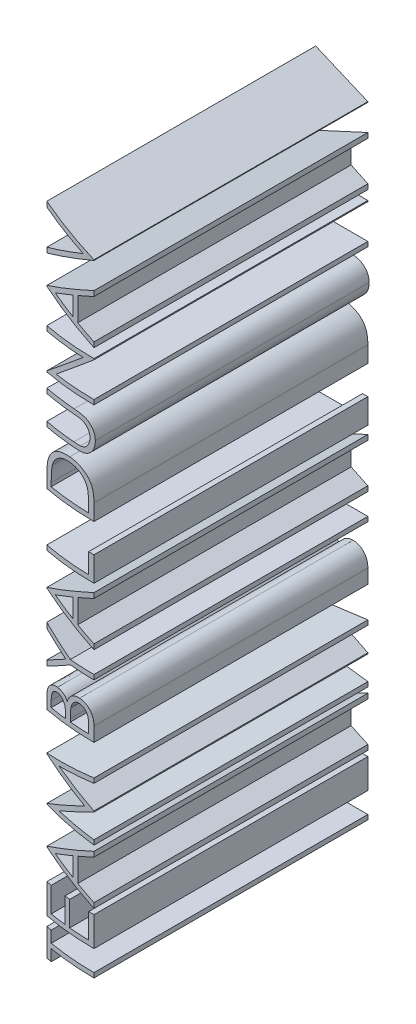
from build123d import *

# Parameters (mm, degrees)
BOSS_EXTRUDE4_DEPTH    = 58
BOSS_EXTRUDE4_2_DEPTH  = 58
BOSS_EXTRUDE4_3_DEPTH  = 58
BOSS_EXTRUDE4_4_DEPTH  = 58
BOSS_EXTRUDE4_5_DEPTH  = 58
BOSS_EXTRUDE4_6_DEPTH  = 58
BOSS_EXTRUDE4_7_DEPTH  = 58
BOSS_EXTRUDE4_8_DEPTH  = 58
BOSS_EXTRUDE4_9_DEPTH  = 58
BOSS_EXTRUDE4_10_DEPTH = 58
BOSS_EXTRUDE4_11_DEPTH = 58
BOSS_EXTRUDE4_12_DEPTH = 58
BOSS_EXTRUDE4_13_DEPTH = 58
SKETCH6_R              = 76.53207951
SKETCH6_R_2            = 50
CUT_EXTRUDE2_DEPTH     = 144


with BuildPart() as part:
    # Sketch4 → Boss-Extrude4 (new body)
    with BuildSketch(Plane.XY):
        Polygon((-8.548076923, 14.736057692), (-9.525, 14.736057692), (-9.525, 19.742788462), (-8.548076923, 19.742788462), (-8.548076923, 17.666826923), (0, 17.666826923), (0, 16.812019231), (-8.548076923, 16.812019231), align=None)
    extrude(amount=BOSS_EXTRUDE4_DEPTH)


with BuildPart() as body_2:
    # Sketch4 → Boss-Extrude4 2 (new body)
    with BuildSketch(Plane.XY):
        Polygon((-9.525, 21.452403846), (-9.525, 26.825480769), (-8.548076923, 26.825480769), (-8.548076923, 22.307211538), (-5.617307692, 22.307211538), (-5.617307692, 26.825480769), (-4.640384615, 26.825480769), (-4.640384615, 22.307211538), (-0.976923077, 22.307211538), (-0.976923077, 26.825480769), (0, 26.825480769), (0, 21.452403846), align=None)
    extrude(amount=BOSS_EXTRUDE4_2_DEPTH)


with BuildPart() as body_3:
    # Sketch4 → Boss-Extrude4 3 (new body)
    with BuildSketch(Plane.XY):
        Polygon((-9.525, 32.442788462), (0, 36.838942308), (0, 35.909720553), (-3.052884615, 34.501577524), (-3.052884615, 30.183653846), (0, 28.735441707), (0, 27.802403846), (-9.525, 32.320673077), align=None)
        Polygon((-7.668464543, 32.372190505), (-4.029807692, 30.647310697), (-4.029807692, 34.051277043), align=None, mode=Mode.SUBTRACT)
    extrude(amount=BOSS_EXTRUDE4_3_DEPTH)


with BuildPart() as body_4:
    # Sketch4 → Boss-Extrude4 4 (new body)
    with BuildSketch(Plane.XY):
        Polygon((0, 37.815865385), (-9.525, 39.073272236), (-9.525, 39.19538762), (-1.709615385, 43.127884615), (-9.525, 47.050841346), (-9.525, 47.174864784), (0, 48.439903846), (0, 47.581280048), (-6.853725962, 46.669230769), (0, 43.230919471), (0, 43.03820613), (-6.868990385, 39.586538462), (0, 38.676397236), align=None)
    extrude(amount=BOSS_EXTRUDE4_4_DEPTH)


with BuildPart() as body_5:
    # Sketch4 → Boss-Extrude4 5 (new body)
    with BuildSketch(Plane.XY):
        with BuildLine():
            Line((-9.525, 54.057211538), (-9.525, 55.915655048))
            add(Edge.make_bspline(
                [(-9.525, 55.915655048), (-9.524529238, 56.006629698), (-9.523616783, 56.182961212), (-9.509136788, 56.439353195), (-9.489887004, 56.679583574), (-9.457596527, 56.903227832), (-9.424115562, 57.111741188), (-9.374973522, 57.303006794), (-9.320694346, 57.478626738), (-9.237178469, 57.689510344), (-9.10747726, 57.928786691), (-8.915118041, 58.185963992), (-8.68449487, 58.409518194), (-8.421681576, 58.599605531), (-8.132557171, 58.752154663), (-7.82334226, 58.861121029), (-7.499239013, 58.931125173), (-7.27703627, 58.938234157), (-7.164738582, 58.941826923)],
                knots=[0, 0, 0, 0, 1.00128172, 1.940733171, 2.826250472, 3.653024905, 4.427672124, 5.149348099, 5.824709082, 6.450061444, 7.643590664, 8.808605388, 9.972104426, 11.165284501, 12.367876273, 13.557044126, 14.765369432, 16, 16, 16, 16], degree=3))
            add(Edge.make_bspline(
                [(-7.164738582, 58.941826923), (-7.059553037, 58.938834411), (-6.852853523, 58.932953843), (-6.551052971, 58.877406845), (-6.264058289, 58.78924582), (-5.992115101, 58.667403728), (-5.740285653, 58.51041701), (-5.509350044, 58.322324855), (-5.308036369, 58.096333634), (-5.195533021, 57.926929853), (-5.138386418, 57.840880409)],
                knots=[0, 0, 0, 0, 1.044641374, 2.052818814, 3.038628718, 4.023282556, 5.005660861, 5.98021751, 6.974042014, 8, 8, 8, 8], degree=3))
            add(Edge.make_bspline(
                [(-5.138386418, 57.840880409), (-5.096830362, 57.949075124), (-5.017323333, 58.156078416), (-4.876975624, 58.441109475), (-4.723772684, 58.685786279), (-4.559052161, 58.894888464), (-4.378882354, 59.072780297), (-4.181799464, 59.226844911), (-3.967964837, 59.360036772), (-3.738164382, 59.473382124), (-3.494346222, 59.562416312), (-3.239488355, 59.627855206), (-2.974567779, 59.666563734), (-2.794787371, 59.671844171), (-2.703710937, 59.674519231)],
                knots=[0, 0, 0, 0, 1.272586185, 2.434772614, 3.483318042, 4.437947805, 5.351807173, 6.25737843, 7.180033415, 8.1141739, 9.066731021, 10.025721652, 10.999834114, 12, 12, 12, 12], degree=3))
            add(Edge.make_bspline(
                [(-2.703710937, 59.674519231), (-2.610727857, 59.671861395), (-2.427781041, 59.666632029), (-2.159031401, 59.628033949), (-1.902176863, 59.562725382), (-1.655674409, 59.472612394), (-1.42004087, 59.355810963), (-1.196129866, 59.211613057), (-0.983475554, 59.042042927), (-0.781702626, 58.850401271), (-0.597074053, 58.636831638), (-0.438355745, 58.401464156), (-0.301880619, 58.150746748), (-0.190767438, 57.881474231), (-0.105043694, 57.594334001), (-0.045317822, 57.289485839), (-0.005007094, 56.967431785), (-0.001697351, 56.746423631), (0, 56.633082933)],
                knots=[0, 0, 0, 0, 0.978680899, 1.925582087, 2.851223405, 3.764209995, 4.683484765, 5.614004905, 6.562443559, 7.542772147, 8.539900013, 9.527881485, 10.525548727, 11.540192123, 12.58875426, 13.674701727, 14.807505862, 16, 16, 16, 16], degree=3))
            Line((0, 56.633082933), (0, 54.057211538))
            Line((0, 54.057211538), (-9.525, 54.057211538))
        make_face()
        with BuildLine():
            Line((-8.548076923, 54.912019231), (-5.495192308, 54.912019231))
            Line((-5.495192308, 54.912019231), (-5.495192308, 55.486343149))
            add(Edge.make_bspline(
                [(-5.495192308, 55.486343149), (-5.496280669, 55.570295942), (-5.498383606, 55.732509848), (-5.504407537, 55.967423278), (-5.521275062, 56.1854778), (-5.538137771, 56.386296975), (-5.565554964, 56.569564717), (-5.598190924, 56.7348745), (-5.63270572, 56.884822355), (-5.691409018, 57.057736642), (-5.778138227, 57.25390549), (-5.912865554, 57.462892786), (-6.073208084, 57.647987527), (-6.259951746, 57.80241527), (-6.463348431, 57.929918428), (-6.681612507, 58.0192384), (-6.91035169, 58.078785367), (-7.067684653, 58.084246494), (-7.147566106, 58.087019231)],
                knots=[0, 0, 0, 0, 1.156917035, 2.235399477, 3.236897345, 4.169954739, 5.01148057, 5.788325709, 6.491867502, 7.129259015, 8.302032419, 9.437271567, 10.542795419, 11.662606952, 12.764338259, 13.836858145, 14.901724648, 16, 16, 16, 16], degree=3))
            add(Edge.make_bspline(
                [(-7.147566106, 58.087019231), (-7.200438886, 58.085611406), (-7.304154617, 58.082849803), (-7.455839406, 58.059410619), (-7.598367472, 58.02143292), (-7.733106724, 57.970000878), (-7.856708571, 57.899737076), (-7.975079026, 57.818292098), (-8.081128279, 57.717736709), (-8.179961954, 57.604100192), (-8.268417762, 57.474079749), (-8.34168969, 57.324874086), (-8.408098402, 57.160340397), (-8.457258796, 56.976014794), (-8.500487656, 56.775716567), (-8.527648638, 56.556733602), (-8.545126988, 56.320453548), (-8.547071679, 56.156741148), (-8.548076923, 56.072115385)],
                knots=[0, 0, 0, 0, 0.911708768, 1.788416306, 2.640049961, 3.452993646, 4.268229297, 5.087074648, 5.92553149, 6.781184137, 7.681934069, 8.628939405, 9.643570426, 10.73771997, 11.914765019, 13.176320755, 14.540391495, 16, 16, 16, 16], degree=3))
            Line((-8.548076923, 56.072115385), (-8.548076923, 54.912019231))
        make_face(mode=Mode.SUBTRACT)
        with BuildLine():
            Line((-4.518269231, 54.912019231), (-0.976923077, 54.912019231))
            Line((-0.976923077, 54.912019231), (-0.976923077, 56.129356971))
            add(Edge.make_bspline(
                [(-0.976923077, 56.129356971), (-0.978071261, 56.216485077), (-0.980284234, 56.384413016), (-0.985474115, 56.627063046), (-1.005106648, 56.851375232), (-1.023217572, 57.0580572), (-1.054186473, 57.246560414), (-1.083413064, 57.418334852), (-1.12679785, 57.570560718), (-1.186425134, 57.7487002), (-1.281881014, 57.947818966), (-1.421341153, 58.165419936), (-1.593456494, 58.355164609), (-1.789205099, 58.518042699), (-2.001456321, 58.652456772), (-2.227435381, 58.748911583), (-2.462747417, 58.808852043), (-2.623228069, 58.816084419), (-2.703710937, 58.819711538)],
                knots=[0, 0, 0, 0, 1.160376723, 2.23647316, 3.230273494, 4.158083346, 4.997711197, 5.773399541, 6.476071462, 7.102777513, 8.27340052, 9.405620712, 10.53304798, 11.669441455, 12.787990954, 13.865552736, 14.929550474, 16, 16, 16, 16], degree=3))
            add(Edge.make_bspline(
                [(-2.703710937, 58.819711538), (-2.754040327, 58.818962441), (-2.853887288, 58.81747633), (-3.000599535, 58.794962109), (-3.142786904, 58.762391165), (-3.281041912, 58.719494296), (-3.413039982, 58.659526785), (-3.539287328, 58.586011642), (-3.662327163, 58.5018605), (-3.81989033, 58.372031205), (-3.999175358, 58.180436285), (-4.172538258, 57.908158524), (-4.314607477, 57.600278437), (-4.374668261, 57.376454166), (-4.405694111, 57.260832332)],
                knots=[0, 0, 0, 0, 0.723302347, 1.434937762, 2.129609326, 2.821140842, 3.513216847, 4.209993937, 4.920569932, 5.655069131, 7.14393391, 8.6716197, 10.280644748, 12, 12, 12, 12], degree=3))
            add(Edge.make_bspline(
                [(-4.405694111, 57.260832332), (-4.415096875, 57.214488864), (-4.435484007, 57.114006666), (-4.457004257, 56.950156036), (-4.476176884, 56.763096279), (-4.490358678, 56.552395449), (-4.505017771, 56.317786967), (-4.510718677, 56.058769781), (-4.517520235, 55.77640166), (-4.518013179, 55.580479561), (-4.518269231, 55.478710938)],
                knots=[0, 0, 0, 0, 0.634451884, 1.375622551, 2.216452059, 3.157844607, 4.20941857, 5.370758133, 6.634282058, 8, 8, 8, 8], degree=3))
            Line((-4.518269231, 55.478710938), (-4.518269231, 54.912019231))
        make_face(mode=Mode.SUBTRACT)
    extrude(amount=BOSS_EXTRUDE4_5_DEPTH)


with BuildPart() as body_6:
    # Sketch4 → Boss-Extrude4 6 (new body)
    with BuildSketch(Plane.XY):
        Polygon((-9.525, 60.895673077), (-9.525, 61.874504207), (-5.432226562, 64.377869591), (-9.525, 66.87741887), (-9.525, 67.85625), (-4.527809495, 64.803365385), (0, 64.803365385), (0, 63.948557692), (-4.527809495, 63.948557692), align=None)
    extrude(amount=BOSS_EXTRUDE4_6_DEPTH)


with BuildPart() as body_7:
    # Sketch4 → Boss-Extrude4 7 (new body)
    with BuildSketch(Plane.XY):
        Polygon((-9.525, 73.351442308), (0, 77.747596154), (0, 76.818374399), (-3.052884615, 75.41023137), (-3.052884615, 71.092307692), (0, 69.644095553), (0, 68.711057692), (-9.525, 73.229326923), align=None)
        Polygon((-7.668464543, 73.280844351), (-4.029807692, 71.555964543), (-4.029807692, 74.959930889), align=None, mode=Mode.SUBTRACT)
    extrude(amount=BOSS_EXTRUDE4_7_DEPTH)


with BuildPart() as body_8:
    # Sketch4 → Boss-Extrude4 8 (new body)
    with BuildSketch(Plane.XY):
        Polygon((-9.525, 79.212980769), (-9.525, 80.067788462), (-0.976923077, 80.067788462), (-0.976923077, 83.73125), (0, 83.73125), (0, 79.212980769), align=None)
    extrude(amount=BOSS_EXTRUDE4_8_DEPTH)


with BuildPart() as body_9:
    # Sketch4 → Boss-Extrude4 9 (new body)
    with BuildSketch(Plane.XY):
        with BuildLine():
            Line((0, 88.982211538), (-9.525, 88.982211538))
            Line((-9.525, 88.982211538), (-9.525, 90.905528846))
            add(Edge.make_bspline(
                [(-9.525, 90.905528846), (-9.523795577, 91.072812307), (-9.521468639, 91.396003083), (-9.50671471, 91.8630341), (-9.480614943, 92.295152768), (-9.442597875, 92.690937906), (-9.395917119, 93.051476061), (-9.337405305, 93.375757702), (-9.268313212, 93.665459605), (-9.209406666, 93.843630012), (-9.181550481, 93.927884615)],
                knots=[0, 0, 0, 0, 1.314313732, 2.53924729, 3.670748893, 4.714932338, 5.66265055, 6.526160246, 7.303039223, 8, 8, 8, 8], degree=3))
            add(Edge.make_bspline(
                [(-9.181550481, 93.927884615), (-9.139569995, 94.038098081), (-9.056561002, 94.256025737), (-8.899735793, 94.566143894), (-8.722775854, 94.859080351), (-8.521608846, 95.132499559), (-8.298861671, 95.387087555), (-8.056125633, 95.625733839), (-7.788008456, 95.842554583), (-7.499282465, 96.040926772), (-7.193647055, 96.219833313), (-6.871602776, 96.375330306), (-6.534807389, 96.504473813), (-6.184191458, 96.611679432), (-5.818985678, 96.696170213), (-5.43876435, 96.753815309), (-5.045030276, 96.791836365), (-4.777855485, 96.79565739), (-4.642292668, 96.797596154)],
                knots=[0, 0, 0, 0, 0.984741985, 1.947153288, 2.898543998, 3.841229145, 4.778974371, 5.722123648, 6.681464302, 7.655713756, 8.646344578, 9.637374342, 10.639946623, 11.656849581, 12.698333139, 13.76849723, 14.867749466, 16, 16, 16, 16], degree=3))
            add(Edge.make_bspline(
                [(-4.642292668, 96.797596154), (-4.524560299, 96.795884462), (-4.292556368, 96.792511396), (-3.95063363, 96.762223777), (-3.61885461, 96.718201008), (-3.298798894, 96.650045264), (-2.987663555, 96.567306082), (-2.688760234, 96.461271274), (-2.399363099, 96.339786692), (-2.123326106, 96.198181777), (-1.861974947, 96.042511698), (-1.615420134, 95.87649423), (-1.389132799, 95.696364224), (-1.177183189, 95.507452983), (-0.985233298, 95.305204939), (-0.809784138, 95.092082432), (-0.653773107, 94.867257211), (-0.514748645, 94.629337544), (-0.390422914, 94.375145953), (-0.286720339, 94.096686827), (-0.196903321, 93.79527917), (-0.125453879, 93.469204131), (-0.067829392, 93.119624719), (-0.029462786, 92.745571193), (-0.00344298, 92.347750464), (-0.001169944, 92.074574519), (0, 91.933969351)],
                knots=[0, 0, 0, 0, 1.106010661, 2.179509527, 3.223302912, 4.248870533, 5.252098245, 6.246278179, 7.226402005, 8.199283979, 9.158616973, 10.083547221, 10.989831858, 11.874256832, 12.749262829, 13.607058236, 14.46581075, 15.317568432, 16.194266721, 17.121067875, 18.106207572, 19.147242834, 20.255495536, 21.43354536, 22.679031616, 24, 24, 24, 24], degree=3))
            Line((0, 91.933969351), (0, 88.982211538))
        make_face()
        with BuildLine():
            Line((-0.976923077, 89.837019231), (-0.976923077, 90.930333534))
            add(Edge.make_bspline(
                [(-0.976923077, 90.930333534), (-0.977598253, 91.087437171), (-0.978896865, 91.389605001), (-0.99029204, 91.824102837), (-1.008911884, 92.221103194), (-1.034969774, 92.580662445), (-1.069446505, 92.902577575), (-1.107886419, 93.187521352), (-1.155776625, 93.434559733), (-1.199186021, 93.584046272), (-1.219245793, 93.653125)],
                knots=[0, 0, 0, 0, 1.375205317, 2.645023457, 3.804390687, 4.853969522, 5.800190428, 6.637939096, 7.370582563, 8, 8, 8, 8], degree=3))
            add(Edge.make_bspline(
                [(-1.219245793, 93.653125), (-1.2498661, 93.740070194), (-1.310375347, 93.911883899), (-1.420750207, 94.15921015), (-1.551492964, 94.389870766), (-1.696824552, 94.607882716), (-1.861864159, 94.810163975), (-2.043047954, 94.999072057), (-2.241203722, 95.174375684), (-2.456010145, 95.333374706), (-2.685137906, 95.477391226), (-2.928992236, 95.601023369), (-3.18414491, 95.708690768), (-3.452661535, 95.79394385), (-3.732574025, 95.86116217), (-4.02533385, 95.908278455), (-4.330681948, 95.937528956), (-4.538555004, 95.941016178), (-4.644200721, 95.942788462)],
                knots=[0, 0, 0, 0, 0.998590647, 1.973329978, 2.929871262, 3.868367705, 4.809062953, 5.754642869, 6.701828697, 7.672172887, 8.647399344, 9.630604387, 10.631475358, 11.644913558, 12.679592956, 13.747988925, 14.855477812, 16, 16, 16, 16], degree=3))
            add(Edge.make_bspline(
                [(-4.644200721, 95.942788462), (-4.755598264, 95.941391587), (-4.974439723, 95.938647414), (-5.295542972, 95.904155183), (-5.604372457, 95.853750093), (-5.900948831, 95.780860204), (-6.185850704, 95.687975455), (-6.457502371, 95.57205718), (-6.718772764, 95.439614452), (-6.963631574, 95.282034657), (-7.195206392, 95.109453649), (-7.407355127, 94.917925278), (-7.600561044, 94.710492444), (-7.777833031, 94.489417604), (-7.932039177, 94.248470212), (-8.069979359, 93.99332624), (-8.187044035, 93.720242663), (-8.249307226, 93.530252398), (-8.280949519, 93.433698918)],
                knots=[0, 0, 0, 0, 1.122418816, 2.205001699, 3.251619955, 4.274784885, 5.280384055, 6.268708349, 7.249350384, 8.229342522, 9.199999885, 10.157847722, 11.105861043, 12.055065948, 13.010012805, 13.98527497, 14.976112212, 16, 16, 16, 16], degree=3))
            add(Edge.make_bspline(
                [(-8.280949519, 93.433698918), (-8.303037798, 93.35382187), (-8.350003539, 93.183981349), (-8.401235445, 92.906832522), (-8.446423404, 92.59491558), (-8.484681353, 92.246845679), (-8.512133278, 91.863019587), (-8.53273807, 91.443142107), (-8.546635405, 90.987031755), (-8.547584387, 90.670849288), (-8.548076923, 90.506745793)],
                knots=[0, 0, 0, 0, 0.674548936, 1.434276114, 2.292660221, 3.240891867, 4.284742987, 5.42552168, 6.663806718, 8, 8, 8, 8], degree=3))
            Line((-8.548076923, 90.506745793), (-8.548076923, 89.837019231))
            Line((-8.548076923, 89.837019231), (-0.976923077, 89.837019231))
        make_face(mode=Mode.SUBTRACT)
    extrude(amount=BOSS_EXTRUDE4_9_DEPTH)


with BuildPart() as body_10:
    # Sketch4 → Boss-Extrude4 10 (new body)
    with BuildSketch(Plane.XY):
        with BuildLine():
            Line((-9.525, 98.751442308), (-9.525, 99.60625))
            Line((-9.525, 99.60625), (-3.818013822, 99.60625))
            add(Edge.make_bspline(
                [(-3.818013822, 99.60625), (-3.73723982, 99.60612279), (-3.583957231, 99.605881386), (-3.365784927, 99.60749387), (-3.171822021, 99.612009723), (-3.001320853, 99.614856771), (-2.855063805, 99.621190443), (-2.732258495, 99.626355842), (-2.633486416, 99.632997643), (-2.575844038, 99.640979913), (-2.551066707, 99.644411058)],
                knots=[0, 0, 0, 0, 1.528628734, 2.90083645, 4.128790002, 5.200304208, 6.127813768, 6.898992206, 7.526736466, 8, 8, 8, 8], degree=3))
            add(Edge.make_bspline(
                [(-2.551066707, 99.644411058), (-2.460991213, 99.658340644), (-2.287104522, 99.685231085), (-2.039664971, 99.756673965), (-1.816249517, 99.851918834), (-1.611818698, 99.970075791), (-1.427671694, 100.119367617), (-1.262395154, 100.304718028), (-1.112200788, 100.522803943), (-0.981252895, 100.770500829), (-0.872489635, 101.034422295), (-0.791106802, 101.305106759), (-0.74130056, 101.577330018), (-0.735548613, 101.759605659), (-0.732692308, 101.850120192)],
                knots=[0, 0, 0, 0, 1.042777144, 2.01303441, 2.939567723, 3.817555404, 4.708046775, 5.641195415, 6.651191522, 7.732783915, 8.843021186, 9.914367358, 10.964315445, 12, 12, 12, 12], degree=3))
            add(Edge.make_bspline(
                [(-0.732692308, 101.850120192), (-0.735598515, 101.927833989), (-0.741394143, 102.082812728), (-0.77772545, 102.312961338), (-0.84191242, 102.537821243), (-0.929346791, 102.75562597), (-1.036867629, 102.962835826), (-1.165675844, 103.154138211), (-1.315712469, 103.325576209), (-1.481994459, 103.482022936), (-1.669375035, 103.61745531), (-1.873333617, 103.737198705), (-2.09930867, 103.832296975), (-2.258022871, 103.880444941), (-2.339272837, 103.905093149)],
                knots=[0, 0, 0, 0, 0.994718802, 1.98369237, 2.973235266, 3.981451368, 4.982709966, 5.955777334, 6.925228988, 7.892833478, 8.871333226, 9.877970804, 10.913677552, 12, 12, 12, 12], degree=3))
            add(Edge.make_bspline(
                [(-2.339272837, 103.905093149), (-2.3728786, 103.913257776), (-2.447765783, 103.931451854), (-2.574370152, 103.948452741), (-2.723747635, 103.966159785), (-2.896971497, 103.978445865), (-3.093461287, 103.990423472), (-3.314240602, 103.997589192), (-3.55850776, 104.00090126), (-3.728970321, 104.001888268), (-3.818013822, 104.002403846)],
                knots=[0, 0, 0, 0, 0.558680831, 1.244966039, 2.062412453, 2.990489873, 4.051219941, 5.244515665, 6.560634259, 8, 8, 8, 8], degree=3))
            Line((-3.818013822, 104.002403846), (-9.525, 104.002403846))
            Line((-9.525, 104.002403846), (-9.525, 104.857211538))
            Line((-9.525, 104.857211538), (-3.772220553, 104.857211538))
            add(Edge.make_bspline(
                [(-3.772220553, 104.857211538), (-3.668538556, 104.85651987), (-3.466196836, 104.855170036), (-3.16969321, 104.843467691), (-2.888426461, 104.824802025), (-2.622353021, 104.798453177), (-2.37244479, 104.763461265), (-2.137055684, 104.724908157), (-1.917483485, 104.674952846), (-1.711194897, 104.617035073), (-1.513835149, 104.551769655), (-1.326897841, 104.46575398), (-1.144892607, 104.369263827), (-0.969857418, 104.255748247), (-0.802904352, 104.125153512), (-0.63971163, 103.98248286), (-0.485142837, 103.82270756), (-0.337291613, 103.650546877), (-0.199789937, 103.467158334), (-0.080132308, 103.271357797), (0.017301447, 103.064226259), (0.103775826, 102.850668444), (0.165239611, 102.625564179), (0.211973335, 102.391717456), (0.23830442, 102.147741214), (0.242238572, 101.981834325), (0.244230769, 101.897821514)],
                knots=[0, 0, 0, 0, 1.316707045, 2.569633854, 3.76780728, 4.896239288, 5.964314126, 6.972204208, 7.924543903, 8.822147865, 9.693191779, 10.560896119, 11.431827672, 12.307838457, 13.206132673, 14.12176355, 15.058527151, 16.026630406, 17.00238624, 17.966538933, 18.934743273, 19.906713913, 20.888635248, 21.892958714, 22.933025263, 24, 24, 24, 24], degree=3))
            add(Edge.make_bspline(
                [(0.244230769, 101.897821514), (0.242096567, 101.806192787), (0.237909269, 101.626417553), (0.213877822, 101.361528434), (0.168728438, 101.107545972), (0.110867298, 100.861991364), (0.032369042, 100.627236942), (-0.064084378, 100.403351885), (-0.174200612, 100.187765527), (-0.304320304, 99.985334976), (-0.446207069, 99.794399632), (-0.602054124, 99.62088306), (-0.765926012, 99.460380528), (-0.943993337, 99.319966629), (-1.132610895, 99.194330444), (-1.332665845, 99.086240427), (-1.543890001, 98.993394882), (-1.690720943, 98.945481061), (-1.764948918, 98.921259014)],
                knots=[0, 0, 0, 0, 1.138939089, 2.234594419, 3.301501784, 4.342532435, 5.367382236, 6.373123747, 7.370098489, 8.372230273, 9.360297234, 10.323289009, 11.268038109, 12.20748145, 13.137029304, 14.081414587, 15.030090602, 16, 16, 16, 16], degree=3))
            add(Edge.make_bspline(
                [(-1.764948918, 98.921259014), (-1.815656139, 98.907169748), (-1.925641229, 98.876609816), (-2.10766803, 98.843883828), (-2.317258628, 98.816372684), (-2.554427367, 98.790503986), (-2.819358076, 98.775239608), (-3.111935911, 98.76185715), (-3.43251465, 98.75134803), (-3.655820153, 98.751410003), (-3.772220553, 98.751442308)],
                knots=[0, 0, 0, 0, 0.625038921, 1.35572334, 2.194682327, 3.136881307, 4.189498639, 5.346923369, 6.617055217, 8, 8, 8, 8], degree=3))
            Line((-3.772220553, 98.751442308), (-9.525, 98.751442308))
        make_face()
    extrude(amount=BOSS_EXTRUDE4_10_DEPTH)


with BuildPart() as body_11:
    # Sketch4 → Boss-Extrude4 11 (new body)
    with BuildSketch(Plane.XY):
        Polygon((0, 107.421634615), (-9.525, 107.421634615), (-9.525, 107.600991587), (-2.028260216, 113.89375), (-9.525, 113.89375), (-9.525, 114.748557692), (0, 114.748557692), (0, 114.553936298), (-7.479567308, 108.276442308), (0, 108.276442308), align=None)
    extrude(amount=BOSS_EXTRUDE4_11_DEPTH)


with BuildPart() as body_12:
    # Sketch4 → Boss-Extrude4 12 (new body)
    with BuildSketch(Plane.XY):
        Polygon((-9.525, 121.098557692), (0, 125.494711538), (0, 124.565489784), (-3.052884615, 123.157346755), (-3.052884615, 118.839423077), (0, 117.391210938), (0, 116.458173077), (-9.525, 120.976442308), align=None)
        Polygon((-7.668464543, 121.027959736), (-4.029807692, 119.303079928), (-4.029807692, 122.707046274), align=None, mode=Mode.SUBTRACT)
    extrude(amount=BOSS_EXTRUDE4_12_DEPTH)


with BuildPart() as body_13:
    # Sketch4 → Boss-Extrude4 13 (new body)
    with BuildSketch(Plane.XY):
        Polygon((-9.525, 126.227403846), (-9.525, 127.143269231), (-2.018719952, 130.318269231), (-9.525, 133.493269231), (-9.525, 134.409134615), (0, 130.379326923), (0, 130.257211538), align=None)
    extrude(amount=BOSS_EXTRUDE4_13_DEPTH)


with BuildPart() as cut_extrude2_tool:
    # Sketch6 → Cut-Extrude2 (new body)
    with BuildSketch(Plane(origin=(0, 0, 0), x_dir=(1, 0, 0), z_dir=(0, 1, 0))):
        Circle(SKETCH6_R)
        Circle(SKETCH6_R_2, mode=Mode.SUBTRACT)
    extrude(amount=CUT_EXTRUDE2_DEPTH)


with BuildPart() as part_1:
    add(part.part)

    # Cut-Extrude2: cut by cut_extrude2_tool
    add(cut_extrude2_tool.part, mode=Mode.SUBTRACT)


with BuildPart() as body_2_1:
    add(body_2.part)

    # Cut-Extrude2: cut by cut_extrude2_tool
    add(cut_extrude2_tool.part, mode=Mode.SUBTRACT)


with BuildPart() as body_3_1:
    add(body_3.part)

    # Cut-Extrude2: cut by cut_extrude2_tool
    add(cut_extrude2_tool.part, mode=Mode.SUBTRACT)


with BuildPart() as body_4_1:
    add(body_4.part)

    # Cut-Extrude2: cut by cut_extrude2_tool
    add(cut_extrude2_tool.part, mode=Mode.SUBTRACT)


with BuildPart() as body_5_1:
    add(body_5.part)

    # Cut-Extrude2: cut by cut_extrude2_tool
    add(cut_extrude2_tool.part, mode=Mode.SUBTRACT)


with BuildPart() as body_6_1:
    add(body_6.part)

    # Cut-Extrude2: cut by cut_extrude2_tool
    add(cut_extrude2_tool.part, mode=Mode.SUBTRACT)


with BuildPart() as body_7_1:
    add(body_7.part)

    # Cut-Extrude2: cut by cut_extrude2_tool
    add(cut_extrude2_tool.part, mode=Mode.SUBTRACT)


with BuildPart() as body_8_1:
    add(body_8.part)

    # Cut-Extrude2: cut by cut_extrude2_tool
    add(cut_extrude2_tool.part, mode=Mode.SUBTRACT)


with BuildPart() as body_9_1:
    add(body_9.part)

    # Cut-Extrude2: cut by cut_extrude2_tool
    add(cut_extrude2_tool.part, mode=Mode.SUBTRACT)


with BuildPart() as body_10_1:
    add(body_10.part)

    # Cut-Extrude2: cut by cut_extrude2_tool
    add(cut_extrude2_tool.part, mode=Mode.SUBTRACT)


with BuildPart() as body_11_1:
    add(body_11.part)

    # Cut-Extrude2: cut by cut_extrude2_tool
    add(cut_extrude2_tool.part, mode=Mode.SUBTRACT)


with BuildPart() as body_12_1:
    add(body_12.part)

    # Cut-Extrude2: cut by cut_extrude2_tool
    add(cut_extrude2_tool.part, mode=Mode.SUBTRACT)


with BuildPart() as body_13_1:
    add(body_13.part)

    # Cut-Extrude2: cut by cut_extrude2_tool
    add(cut_extrude2_tool.part, mode=Mode.SUBTRACT)


solid = Compound([part_1.part, body_2_1.part, body_3_1.part, body_4_1.part, body_5_1.part, body_6_1.part, body_7_1.part, body_8_1.part, body_9_1.part, body_10_1.part, body_11_1.part, body_12_1.part, body_13_1.part])
